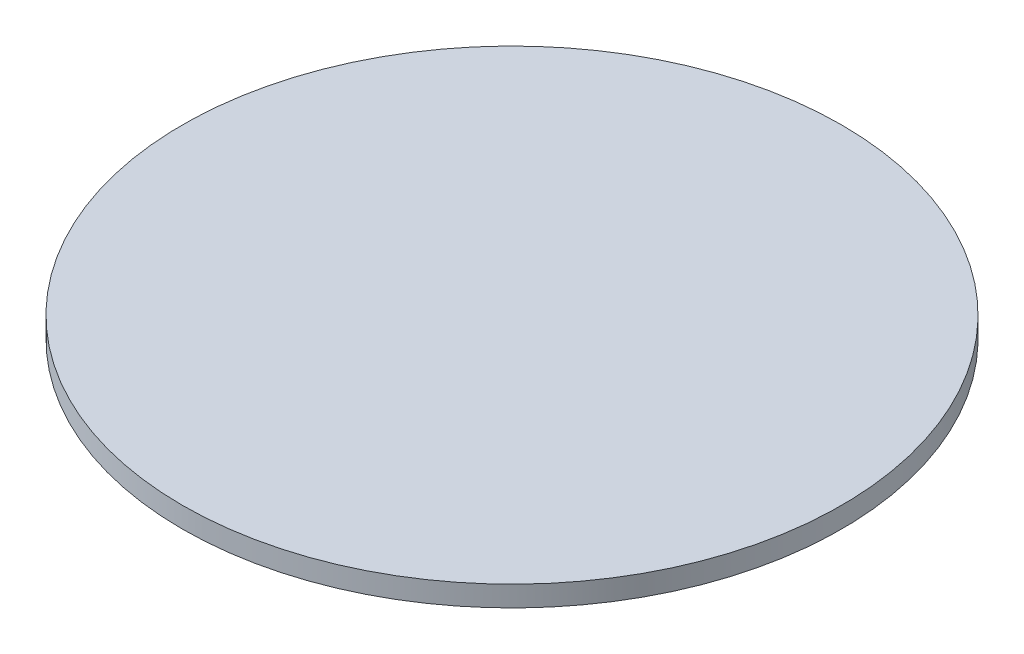
from build123d import *

# Parameters (mm, degrees)
SKETCH1_R      = 50.8
EXTRUDE1_DEPTH = 3.175


with BuildPart() as part:
    # Sketch1 → Extrude1 (new body)
    with BuildSketch(Plane(origin=(0, 0, 0), x_dir=(1, 0, 0), z_dir=(0, 1, 0))):
        with Locations(Location((0, 0, 0), (0, 0, 270))):
            Circle(SKETCH1_R)
    extrude(amount=EXTRUDE1_DEPTH)


solid = part.part
